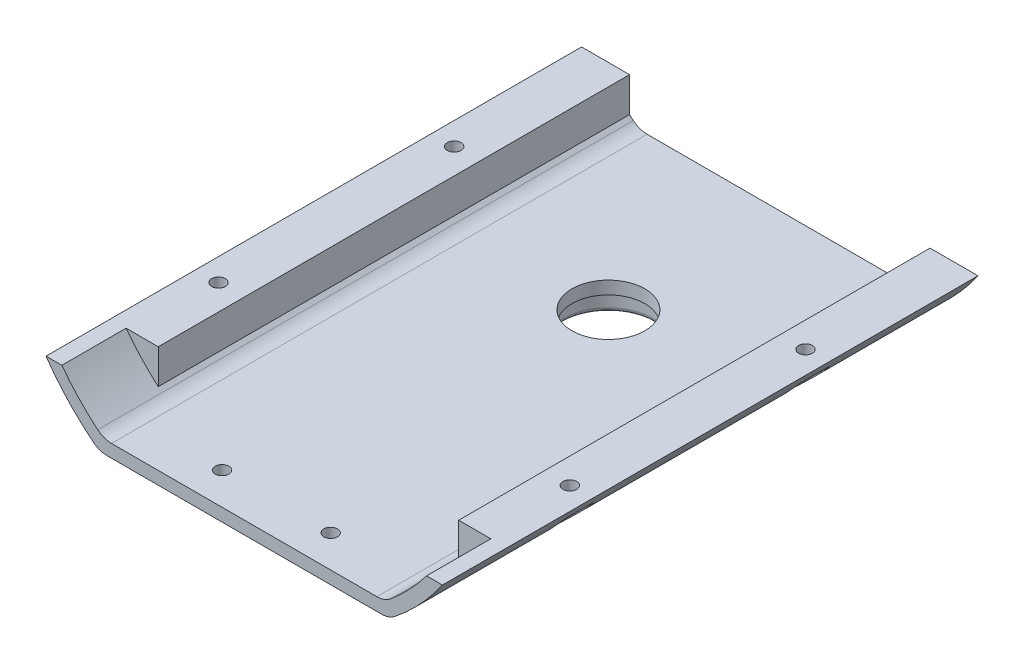
from build123d import *

# Parameters (mm, degrees)
Y_KSEKLIK_EKSTR_ZYON1_DEPTH             = 125
KES_EKSTR_ZYON1_START                   = -15
KES_EKSTR_ZYON1_DEPTH                   = 15
M3_BO_LUKLU_DELIK1_D                    = 3.2
M3_BO_LUKLU_DELIK1_DEPTH                = 11.5
M3_BO_LUKLU_DELIK1_TIP                  = 0.96137699
IZIM8_R                                 = 4
KES_EKSTR_ZYON2_DEPTH                   = 9
M3_BO_LUKLU_DELIK2_D                    = 3.2
M3_BO_LUKLU_DELIK2_DEPTH                = 11.5
M3_BO_LUKLU_DELIK2_TIP                  = 0.96137699
M3X0_5_HELISARMAL_IN_DI_LI_DELIK1_D     = 3.15
M3X0_5_HELISARMAL_IN_DI_LI_DELIK1_DEPTH = 9
M3X0_5_HELISARMAL_IN_DI_LI_DELIK1_TIP   = 0.946355475
IZIM13_R                                = 8.5
KES_EKSTR_ZYON3_DEPTH                   = 10
IZIM14_R                                = 13.5
IZIM14_R_2                              = 10.5
Y_KSEKLIK_EKSTR_ZYON2_DEPTH             = 5
RADYUS1_R                               = 1


with BuildPart() as part:
    # Çizim1 → Yükseklik-Ekstrüzyon1 (new body)
    with BuildSketch(Plane.XY):
        with BuildLine():
            ThreePointArc((-32.040014045, -45), (-33.696486936, -44.717636862), (-35.165869074, -43.902439024))
            ThreePointArc((-35.165869074, -43.902439024), (-41.1459963, -38.354523703), (-46.260809548, -32))
            Line((-46.260809548, -32), (-42.562454112, -32))
            Line((-42.562454112, -32), (-35.062454112, -32))
            Line((-35.062454112, -32), (-35.062454112, -40.077260531))
            ThreePointArc((-35.062454112, -40.077260531), (-34.622260448, -40.458146046), (-34.17792949, -40.834196891))
            ThreePointArc((-34.17792949, -40.834196891), (-32.675927184, -41.699520425), (-30.968734233, -42))
            Line((-30.968734233, -42), (30.968734233, -42))
            ThreePointArc((30.968734233, -42), (32.675927184, -41.699520425), (34.17792949, -40.834196891))
            ThreePointArc((34.17792949, -40.834196891), (34.622260448, -40.458146046), (35.062454112, -40.077260531))
            Line((35.062454112, -40.077260531), (35.062454112, -32))
            Line((35.062454112, -32), (42.562454112, -32))
            Line((42.562454112, -32), (46.260809548, -32))
            ThreePointArc((46.260809548, -32), (41.1459963, -38.354523703), (35.165869074, -43.902439024))
            ThreePointArc((35.165869074, -43.902439024), (33.696486936, -44.717636862), (32.040014045, -45))
            Line((32.040014045, -45), (-32.040014045, -45))
        make_face()
    extrude(amount=Y_KSEKLIK_EKSTR_ZYON1_DEPTH)

    # Çizim2 → Kes-Ekstrüzyon1 (cut)
    with BuildSketch(Plane.XY.offset(125).offset(KES_EKSTR_ZYON1_START)):
        with BuildLine():
            Line((30.968734233, -42), (-30.968734233, -42))
            ThreePointArc((-30.968734233, -42), (-32.675927184, -41.699520425), (-34.17792949, -40.834196891))
            ThreePointArc((-34.17792949, -40.834196891), (0, 53.25), (34.17792949, -40.834196891))
            ThreePointArc((34.17792949, -40.834196891), (32.675927184, -41.699520425), (30.968734233, -42))
        make_face()
    extrude(amount=KES_EKSTR_ZYON1_DEPTH, mode=Mode.SUBTRACT)

    # M3 Boşluklu Delik1
    with Locations(Plane(origin=(0, -45, 0), x_dir=(-1, 0, 0), z_dir=(0, -1, 0))):
        with Locations((-12.67, -117.5), (12.67, -117.5)):
            Hole(M3_BO_LUKLU_DELIK1_D / 2, depth=M3_BO_LUKLU_DELIK1_DEPTH)
            with Locations((0, 0, -(M3_BO_LUKLU_DELIK1_DEPTH + M3_BO_LUKLU_DELIK1_TIP / 2))):  # 118° drill point
                Cone(0, M3_BO_LUKLU_DELIK1_D / 2, M3_BO_LUKLU_DELIK1_TIP, mode=Mode.SUBTRACT)

    # Çizim8 → Kes-Ekstrüzyon2 (cut)
    with BuildSketch(Plane.XZ.offset(45)):
        with Locations((-41, 90)):
            Circle(IZIM8_R)
        with Locations((41, 90)):
            Circle(IZIM8_R)
        with Locations((-41, 35)):
            Circle(IZIM8_R)
        with Locations((41, 35)):
            Circle(IZIM8_R)
    extrude(amount=-KES_EKSTR_ZYON2_DEPTH, mode=Mode.SUBTRACT)

    # M3 Boşluklu Delik2
    with Locations(Plane(origin=(-41, -36, 90), x_dir=(0, 0, -1), z_dir=(0, -1, 0))):
        with Locations((0, 0), (55, 0), (0, 82), (55, 82)):
            Hole(M3_BO_LUKLU_DELIK2_D / 2, depth=M3_BO_LUKLU_DELIK2_DEPTH)
            with Locations((0, 0, -(M3_BO_LUKLU_DELIK2_DEPTH + M3_BO_LUKLU_DELIK2_TIP / 2))):  # 118° drill point
                Cone(0, M3_BO_LUKLU_DELIK2_D / 2, M3_BO_LUKLU_DELIK2_TIP, mode=Mode.SUBTRACT)

    # M3x0.5 Helisarmal İçin Dişli Delik1
    with Locations(Plane(origin=(0, 0, 0), x_dir=(-1, 0, 0), z_dir=(0, 0, -1))):
        with Locations((38.338421514, -35.130690796), (-38.338421514, -35.130690796)):
            Hole(M3X0_5_HELISARMAL_IN_DI_LI_DELIK1_D / 2, depth=M3X0_5_HELISARMAL_IN_DI_LI_DELIK1_DEPTH)
            with Locations((0, 0, -(M3X0_5_HELISARMAL_IN_DI_LI_DELIK1_DEPTH + M3X0_5_HELISARMAL_IN_DI_LI_DELIK1_TIP / 2))):  # 118° drill point
                Cone(0, M3X0_5_HELISARMAL_IN_DI_LI_DELIK1_D / 2, M3X0_5_HELISARMAL_IN_DI_LI_DELIK1_TIP, mode=Mode.SUBTRACT)

    # Çizim13 → Kes-Ekstrüzyon3 (cut)
    with BuildSketch(Plane.XZ.offset(45)):
        with Locations(Location((0, 40, 0), (0, 0, 270))):
            Circle(IZIM13_R)
    extrude(amount=-KES_EKSTR_ZYON3_DEPTH, mode=Mode.SUBTRACT)

    # Çizim14 → Yükseklik-Ekstrüzyon2 (add)
    with BuildSketch(Plane.XZ.offset(45)):
        with Locations(Location((0, 40, 0), (0, 0, 90))):
            Circle(IZIM14_R)
        with Locations(Location((0, 40, 0), (0, 0, 270))):
            Circle(IZIM14_R_2, mode=Mode.SUBTRACT)
    extrude(amount=Y_KSEKLIK_EKSTR_ZYON2_DEPTH)

    # Radyus1
    radyus1_edges = [part.edges().sort_by_distance(p)[0] for p in [
        (0, -45, 26.5),
        (0, -50, 26.5),
        (0, -50, 50.5),
    ]]
    fillet(radyus1_edges, radius=RADYUS1_R)


solid = part.part
